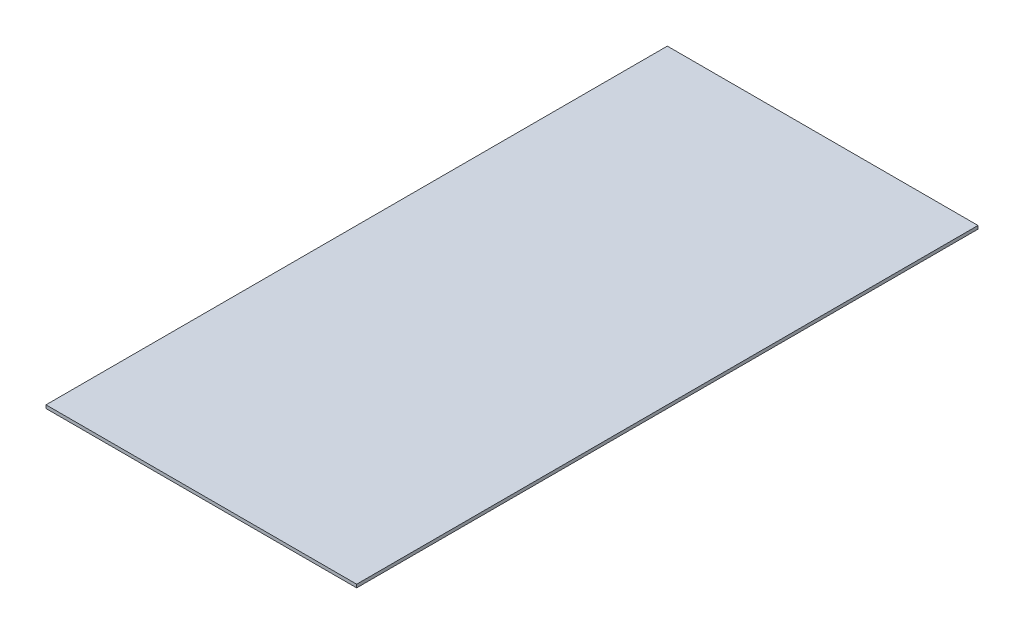
from build123d import *

# Parameters (mm, degrees)
SKETCH1_W           = 1219.2
SKETCH1_H           = 2438.4
BOSS_EXTRUDE1_DEPTH = 12.7


with BuildPart() as part:
    # Sketch1 → Boss-Extrude1 (new body)
    with BuildSketch(Plane(origin=(0, 0, 0), x_dir=(1, 0, 0), z_dir=(0, 1, 0))):
        with Locations((609.6, 1219.2)):
            Rectangle(SKETCH1_W, SKETCH1_H)
    extrude(amount=BOSS_EXTRUDE1_DEPTH)


solid = part.part
